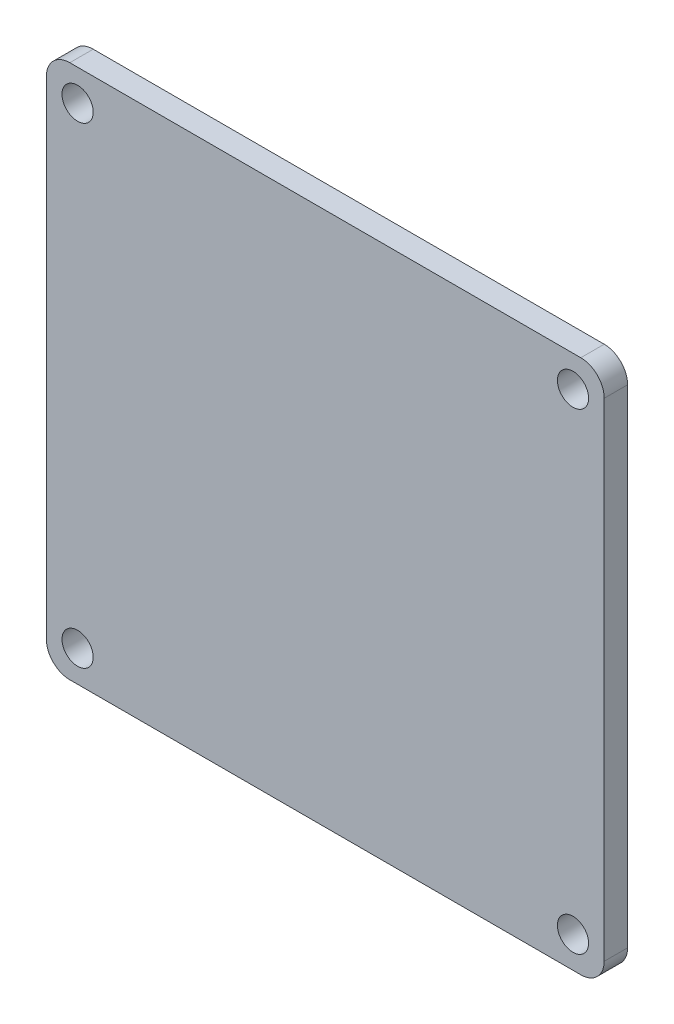
from build123d import *

# Parameters (mm, degrees)
ESBO_O1_W                = 71.5
ESBO_O1_H                = 68.5
ESBO_O1_R                = 2
RESSALTO_EXTRUS_O1_DEPTH = 3
FILETE1_R                = 3


with BuildPart() as part:
    # Esboço1 → Ressalto-extrusão1 (new body)
    with BuildSketch(Plane.XY):
        with Locations((35.75, 34.25)):
            Rectangle(ESBO_O1_W, ESBO_O1_H)
        with Locations((4, 64.5)):
            Circle(ESBO_O1_R, mode=Mode.SUBTRACT)
        with Locations(Location((67.5, 64.5, 0), (0, 0, 180))):
            Circle(ESBO_O1_R, mode=Mode.SUBTRACT)
        with Locations((67.5, 4)):
            Circle(ESBO_O1_R, mode=Mode.SUBTRACT)
        with Locations(Location((4, 4, 0), (0, 0, 180))):
            Circle(ESBO_O1_R, mode=Mode.SUBTRACT)
    extrude(amount=RESSALTO_EXTRUS_O1_DEPTH)

    # Filete1
    filete1_edges = [part.edges().sort_by_distance(p)[0] for p in [
        (0, 68.5, 1.5),
        (71.5, 68.5, 1.5),
        (71.5, 0, 1.5),
        (0, 0, 1.5),
    ]]
    fillet(filete1_edges, radius=FILETE1_R)


solid = part.part
